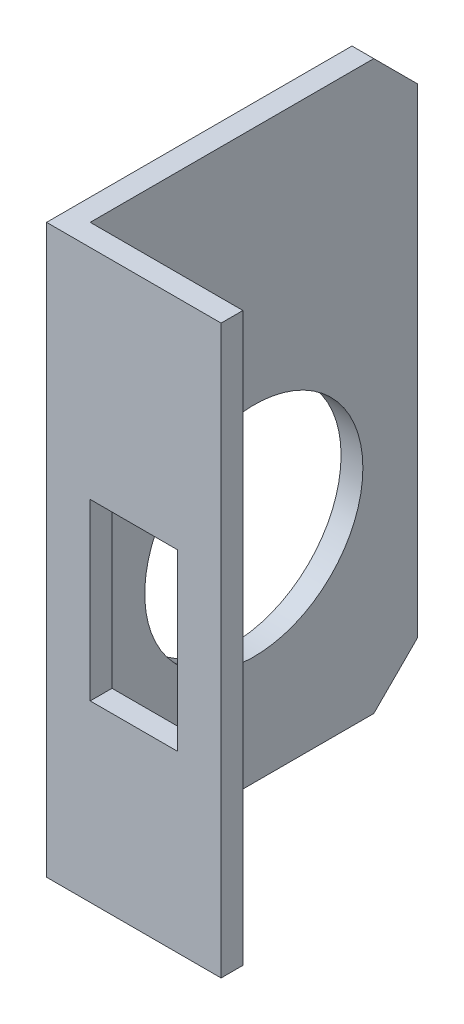
from build123d import *

# Parameters (mm, degrees)
BOSS_EXTRUDE1_DEPTH      = 44.45
BOSS_EXTRUDE1_DEPTH_BACK = 38.1
SKETCH1_W                = 22.225
SKETCH1_H                = 3.175
SKETCH1_W_2              = 3.175
SKETCH1_H_2              = 47.625
SKETCH2_R                = 15.875
CUT_EXTRUDE1_DEPTH       = 3.175
SKETCH3_W                = 12.7
SKETCH3_H                = 25.4
CUT_EXTRUDE2_DEPTH       = 3.175


with BuildPart() as part:
    # Sketch1 → Boss-Extrude1 (new, two sides: drawn at the far end of the back side and taken through both)
    with BuildSketch(Plane(origin=(0, 0, 0), x_dir=(1, 0, 0), z_dir=(0, 1, 0)).offset(-BOSS_EXTRUDE1_DEPTH_BACK)):
        with Locations((1.5875, 0)):
            Rectangle(SKETCH1_W, SKETCH1_H)
        with Locations((-11.1125, 25.4)):
            Rectangle(SKETCH1_W_2, SKETCH1_H_2)
        with Locations((-11.1125, 0)):
            Rectangle(SKETCH1_W_2, SKETCH1_H)
    extrude(amount=BOSS_EXTRUDE1_DEPTH + BOSS_EXTRUDE1_DEPTH_BACK)

    # Sketch2 → Cut-Extrude1 (cut)
    with BuildSketch(Plane(origin=(-9.525, 0, 0), x_dir=(0, 0, -1), z_dir=(1, 0, 0))):
        with Locations((25.4, -6.35)):
            Circle(SKETCH2_R)
        Polygon((49.2125, 38.1), (42.8625, 44.45), (49.2125, 44.45), align=None)
        Polygon((42.8625, -38.1), (49.2125, -38.1), (49.2125, -31.75), align=None)
    extrude(amount=-CUT_EXTRUDE1_DEPTH, mode=Mode.SUBTRACT)

    # Sketch3 → Cut-Extrude2 (cut)
    with BuildSketch(Plane.XY.offset(1.5875)):
        Rectangle(SKETCH3_W, SKETCH3_H)
    extrude(amount=-CUT_EXTRUDE2_DEPTH, mode=Mode.SUBTRACT)


solid = part.part
